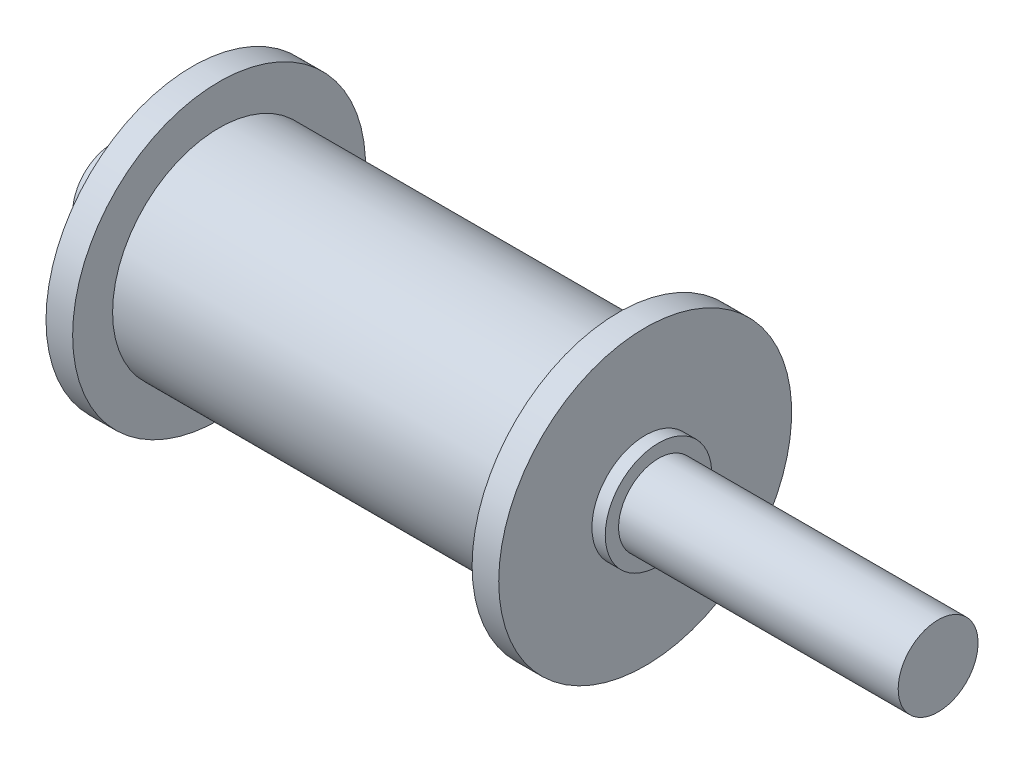
from build123d import *


with BuildPart() as part:
    # 草图2 → 旋转1 (revolve)
    with BuildSketch(Plane.XY, mode=Mode.PRIVATE) as revolve_1_sk:
        Polygon((32, 11), (34, 11), (34, 4), (35, 4), (35, 3), (56, 3), (56, 0), (-6, 0), (-6, 3), (-1, 3), (-1, 4), (0, 4), (0, 11), (2, 11), (2, 8), (32, 8), align=None)
    revolve(revolve_1_sk.sketch.rotate(Axis((-6, 0, 0), (1, 0, 0)), 90), axis=Axis((-6, 0, 0), (1, 0, 0)))


solid = part.part
